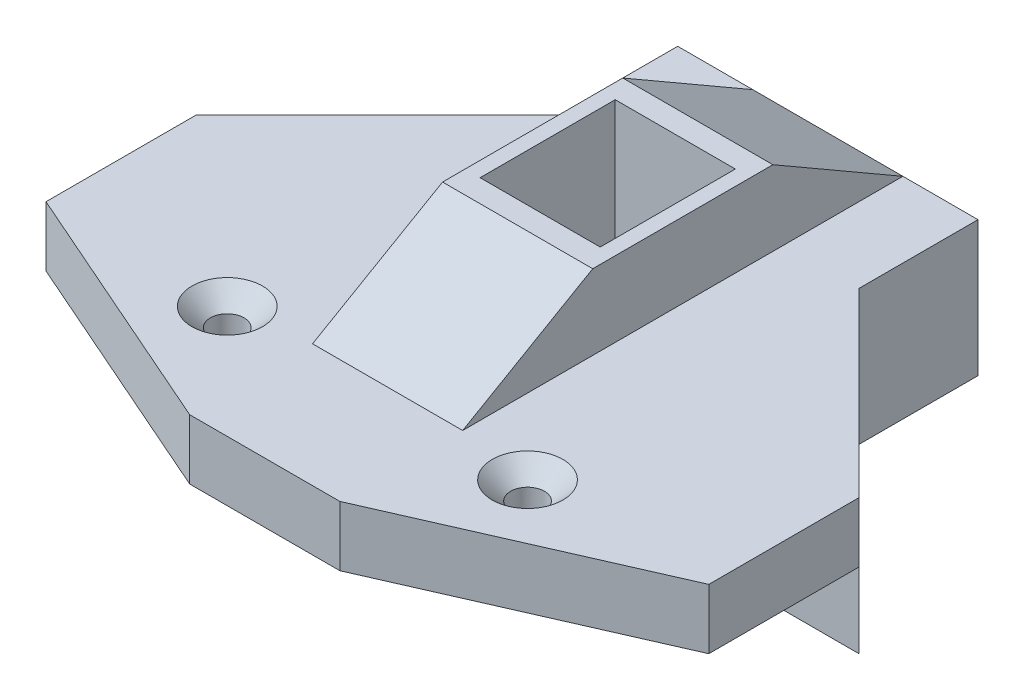
from build123d import *

# Parameters (mm, degrees)
EXTRUDE_1_DEPTH             = 10
EXTRUDE_1_2_DEPTH           = 10
EXTRUDE_2_DEPTH             = 8
HOLE_WIZARD_M41_D           = 4.5
HOLE_WIZARD_M41_CSINK_D     = 9.4
HOLE_WIZARD_M41_CSINK_ANGLE = 90
EXTRUDE_3_DEPTH             = 10
SKETCH_8_W                  = 16
SKETCH_8_H                  = 18
CUT_EXTRUDE_1_DEPTH         = 20


with BuildPart() as part:
    # Эскиз1 → Бобышка-Вытянуть1 (new body)
    with BuildSketch(Plane(origin=(0, 0, 0), x_dir=(1, 0, 0), z_dir=(0, 1, 0))):
        Polygon((-30, 20), (-44.142135624, 20), (-20, 44.142135624), (-20, 60), (-10, 60), (-10, 40), align=None)
    extrude(amount=EXTRUDE_1_DEPTH)



with BuildPart() as body_2:
    # Эскиз1 → Extrude 1 2 (new body)
    with BuildSketch(Plane(origin=(0, 0, 0), x_dir=(1, 0, 0), z_dir=(0, 1, 0))):
        Polygon((30, 20), (10, 40), (10, 60), (20, 60), (20, 44.142135624), (44.142135624, 20), align=None)
    extrude(amount=EXTRUDE_1_2_DEPTH)


with BuildPart() as part_1:
    add(part.part)

    add(body_2.part)  # Бобышка-Вытянуть2 merges body 2
    # Эскиз2 → Бобышка-Вытянуть2 (add)
    with BuildSketch(Plane(origin=(0, 10, 0), x_dir=(1, 0, 0), z_dir=(0, 1, 0))):
        Polygon((44.142135624, 20), (20, 44.142135624), (20, 60), (10, 60), (-10, 60), (-20, 60), (-20, 44.142135624), (-44.142135624, 20), (-44.142135624, 0), (-10, -15), (10, -15), (44.142135624, 0), align=None)
    extrude(amount=EXTRUDE_2_DEPTH)

    # Зенковка для винта с полупотайной головкой M41 (through all)
    with Locations(Plane(origin=(0, 18, 0), x_dir=(1, 0, 0), z_dir=(0, 1, 0))):
        with Locations((-20, 0), (20, 0)):
            CounterSinkHole(HOLE_WIZARD_M41_D / 2, HOLE_WIZARD_M41_CSINK_D / 2, counter_sink_angle=HOLE_WIZARD_M41_CSINK_ANGLE)

    # Эскиз7 → Бобышка-Вытянуть3 (add, symmetric)
    with BuildSketch(Plane(origin=(0, 0, 0), x_dir=(0, 0, -1), z_dir=(1, 0, 0))):
        Polygon((44.142135624, 18), (60, 18), (42.679491924, 28), (18.679491924, 28), (1.358983849, 18), align=None)
    extrude(amount=EXTRUDE_3_DEPTH, both=True)

    # Эскиз8 → Вырез-Вытянуть1 (cut)
    with BuildSketch(Plane(origin=(0, 28, 0), x_dir=(1, 0, 0), z_dir=(0, 1, 0))):
        with Locations((0, 30.679491924)):
            Rectangle(SKETCH_8_W, SKETCH_8_H)
    extrude(amount=-CUT_EXTRUDE_1_DEPTH, mode=Mode.SUBTRACT)


solid = part_1.part
